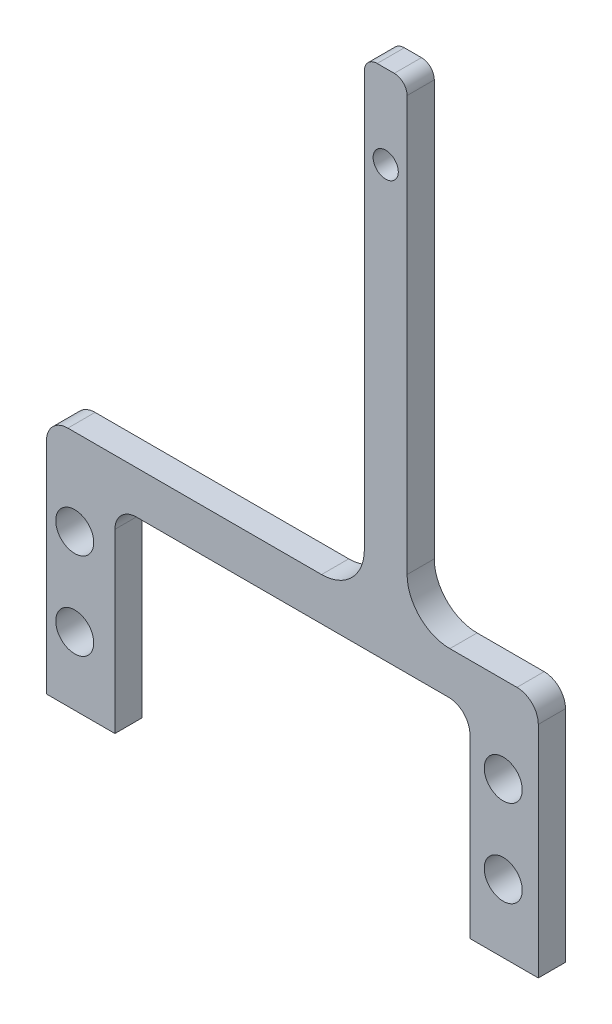
from build123d import *

# Parameters (mm, degrees)
BOSS_EXTRUDE1_DEPTH = 3.18
SKETCH2_R           = 1.47
CUT_EXTRUDE1_DEPTH  = 76.74084037
SKETCH5_W           = 8
SKETCH5_H           = 3.18
BOSS_EXTRUDE2_DEPTH = 3.18
SKETCH6_R           = 2.2225
CUT_EXTRUDE2_DEPTH  = 76.74084037
FILLET1_R           = 5
FILLET2_R           = 1.5
FILLET3_R           = 2.5


with BuildPart() as part:
    # Sketch1 → Boss-Extrude1 (new body)
    with BuildSketch(Plane.XY):
        Polygon((28.75, 15), (13.41, 15), (13.41, 70), (8.41, 70), (8.41, 15), (-28.75, 15), (-28.75, -10), (-20.75, -10), (-20.75, 10), (20.75, 10), (20.75, -10), (28.75, -10), align=None)
    extrude(amount=BOSS_EXTRUDE1_DEPTH)

    # Sketch2 → Cut-Extrude1 (cut, through all)
    with BuildSketch(Plane(origin=(0, 0, 0), x_dir=(-1, 0, 0), z_dir=(0, 0, -1))):
        with Locations((-10.91, 60.25)):
            Circle(SKETCH2_R)
    extrude(amount=-CUT_EXTRUDE1_DEPTH, mode=Mode.SUBTRACT)

    # Sketch5 → Boss-Extrude2 (add)
    with BuildSketch(Plane.XZ.offset(10)):
        with Locations((24.75, 1.59)):
            Rectangle(SKETCH5_W, SKETCH5_H)
        with Locations((-24.75, 1.59)):
            Rectangle(SKETCH5_W, SKETCH5_H)
    extrude(amount=BOSS_EXTRUDE2_DEPTH)

    # Sketch6 → Cut-Extrude2 (cut, through all)
    with BuildSketch(Plane.XY.offset(3.18)):
        with Locations((-25.449, 4.9225)):
            Circle(SKETCH6_R)
        with Locations((-25.449, -5.2375)):
            Circle(SKETCH6_R)
        with Locations((24.649, 4.9225)):
            Circle(SKETCH6_R)
        with Locations((24.649, -5.2375)):
            Circle(SKETCH6_R)
    extrude(amount=-CUT_EXTRUDE2_DEPTH, mode=Mode.SUBTRACT)

    # Fillet1
    fillet1_edges = [part.edges().sort_by_distance(p)[0] for p in [
        (8.41, 15, 1.59),
        (13.41, 15, 1.59),
    ]]
    fillet(fillet1_edges, radius=FILLET1_R)

    # Fillet2
    fillet2_edges = [part.edges().sort_by_distance(p)[0] for p in [
        (8.41, 70, 1.59),
        (13.41, 70, 1.59),
    ]]
    fillet(fillet2_edges, radius=FILLET2_R)

    # Fillet3
    fillet3_edges = [part.edges().sort_by_distance(p)[0] for p in [
        (28.75, 15, 1.59),
        (20.75, 10, 1.59),
        (-20.75, 10, 1.59),
        (-28.75, 15, 1.59),
    ]]
    fillet(fillet3_edges, radius=FILLET3_R)


solid = part.part
